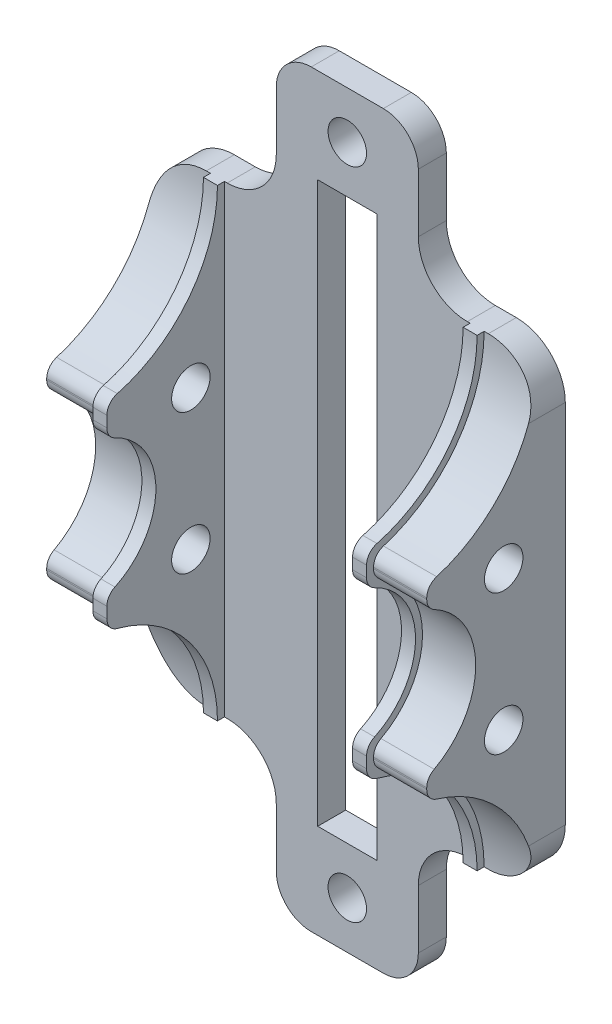
from build123d import *

# Parameters (mm, degrees)
SKETCH1_R               = 2.75
BOSS_EXTRUDE1_DEPTH     = 4
FILLET1_R               = 5
BOSS_EXTRUDE3_DEPTH     = 9.6
BOSS_EXTRUDE4_DEPTH     = 10
BOSS_EXTRUDE5_DEPTH     = 4
BOSS_EXTRUDE6_START     = -12
BOSS_EXTRUDE6_DEPTH     = 12
CUT_EXTRUDE1_START      = -10
CUT_EXTRUDE1_DEPTH      = 10
BOSS_EXTRUDE7_DEPTH     = 4
BOSS_EXTRUDE8_START     = -7.6
BOSS_EXTRUDE8_DEPTH     = 7.6
BOSS_EXTRUDE9_START     = 2
BOSS_EXTRUDE9_DEPTH     = 2
FILLET2_R               = 7
SKETCH15_W              = 8.45
SKETCH15_H              = 80
CUT_EXTRUDE2_DEPTH      = 14
FILLET3_R               = 2
CUT_EXTRUDE4_DEPTH      = 132.997651535
CUT_EXTRUDE4_DEPTH_BACK = 132.997651535
SKETCH17_R              = 2.75


with BuildPart() as part:
    # Sketch1 → Boss-Extrude1 (new body)
    with BuildSketch(Plane.XY):
        Polygon((-62.15, 75), (-69.55, 75), (-69.55, 65.75), (-62.15, 65.75), (-62.15, 64.25), (-69.55, 64.25), (-69.55, 55), (-62.15, 55), (-62.15, 11.5), (-41.85, 11.5), (-41.85, 55), (-34.45, 55), (-34.45, 64.25), (-41.85, 64.25), (-41.85, 65.75), (-34.45, 65.75), (-34.45, 75), (-41.85, 75), (-41.85, 118.5), (-62.15, 118.5), align=None)
        with Locations((-52, 111.75)):
            Circle(SKETCH1_R, mode=Mode.SUBTRACT)
        with Locations((-52, 18.25)):
            Circle(SKETCH1_R, mode=Mode.SUBTRACT)
    extrude(amount=BOSS_EXTRUDE1_DEPTH)

    # Fillet1
    fillet1_edges = [part.edges().sort_by_distance(p)[0] for p in [
        (-62.15, 118.5, 2),
        (-41.85, 118.5, 2),
        (-41.85, 11.5, 2),
        (-62.15, 11.5, 2),
    ]]
    fillet(fillet1_edges, radius=FILLET1_R)



with BuildPart() as body_2:
    # Sketch3 → Boss-Extrude3 (new body)
    with BuildSketch(Plane(origin=(-34.45, 0, 0), x_dir=(0, 0, -1), z_dir=(1, 0, 0))):
        with BuildLine():
            Line((-12.8, 65), (-4, 65))
            Line((-4, 65), (-4, 65.75))
            Line((-4, 65.75), (-4, 75))
            Line((-4, 75), (-4, 98.135455405))
            ThreePointArc((-4, 98.135455405), (-8.435930345, 85.488200598), (-19.8, 78.382677882))
            Line((-19.8, 78.382677882), (-19.8, 75.382677882))
            ThreePointArc((-19.8, 75.382677882), (-14.713450587, 71.260990337), (-12.8, 65))
        make_face()
        with BuildLine():
            Line((-4, 31.864544449), (-4, 65))
            Line((-4, 65), (-12.8, 65))
            ThreePointArc((-12.8, 65), (-14.713450587, 58.739009663), (-19.8, 54.617322118))
            Line((-19.8, 54.617322118), (-19.8, 51.617322118))
            ThreePointArc((-19.8, 51.617322118), (-8.435930299, 44.511799345), (-4, 31.864544449))
        make_face()
    extrude(amount=BOSS_EXTRUDE3_DEPTH)


with BuildPart() as part_1:
    add(part.part)

    add(body_2.part)  # Boss-Extrude4 merges body 2
    # Sketch5 → Boss-Extrude4 (add)
    with BuildSketch(Plane.ZY.offset(34.45)):
        with BuildLine():
            Line((4, 98.135455551), (4, 31.864544449))
            ThreePointArc((4, 31.864544449), (8.435930299, 44.511799345), (19.8, 51.617322118))
            Line((19.8, 51.617322118), (19.8, 54.617322118))
            ThreePointArc((19.8, 54.617322118), (12.8, 65), (19.8, 75.382677882))
            Line((19.8, 75.382677882), (19.8, 78.382677882))
            ThreePointArc((19.8, 78.382677882), (8.435930299, 85.488200655), (4, 98.135455551))
        make_face()
    extrude(amount=BOSS_EXTRUDE4_DEPTH)

    # Sketch6 → Boss-Extrude5 (add)
    with BuildSketch(Plane(origin=(0, 0, 4), x_dir=(-1, 0, 0), z_dir=(0, 0, -1))):
        Polygon((24.85, 31.864544449), (41.85, 31.864544449), (41.85, 55), (34.45, 55), (34.45, 64.25), (41.85, 64.25), (41.85, 65.75), (34.45, 65.75), (34.45, 75), (41.85, 75), (41.85, 98.135455551), (24.85, 98.135455551), align=None)
    extrude(amount=BOSS_EXTRUDE5_DEPTH)

    # Sketch9 → Boss-Extrude6 (add)
    with BuildSketch(Plane.ZY.offset(44.45).offset(BOSS_EXTRUDE6_START)):
        with BuildLine():
            Line((4, 31.864544449), (5, 31.864544449))
            ThreePointArc((5, 31.864544449), (9.468774813, 44.195523989), (20.8, 50.800547872))
            Line((20.8, 50.800547872), (20.8, 55.31495999))
            ThreePointArc((20.8, 55.31495999), (20.485627959, 55.424552796), (20.175, 55.544346929))
            ThreePointArc((20.175, 55.544346929), (13.8, 65), (20.175, 74.455653071))
            ThreePointArc((20.175, 74.455653071), (20.485627959, 74.575447204), (20.8, 74.68504001))
            Line((20.8, 74.68504001), (20.8, 79.199452128))
            ThreePointArc((20.8, 79.199452128), (9.468774813, 85.804476011), (5, 98.135455551))
            Line((5, 98.135455551), (4, 98.135455551))
            ThreePointArc((4, 98.135455551), (8.435930299, 85.488200655), (19.8, 78.382677882))
            Line((19.8, 78.382677882), (19.8, 75.382677882))
            ThreePointArc((19.8, 75.382677882), (12.8, 65), (19.8, 54.617322118))
            Line((19.8, 54.617322118), (19.8, 51.617322118))
            ThreePointArc((19.8, 51.617322118), (8.435930299, 44.511799345), (4, 31.864544449))
        make_face()
    extrude(amount=BOSS_EXTRUDE6_DEPTH)

    # Sketch10 → Cut-Extrude1 (cut)
    with BuildSketch(Plane.ZY.offset(44.45).offset(CUT_EXTRUDE1_START)):
        with BuildLine():
            Line((4, 98.135455551), (4, 31.864544449))
            Line((4, 31.864544449), (5, 31.864544449))
            ThreePointArc((5, 31.864544449), (9.468774813, 44.195523989), (20.8, 50.800547872))
            Line((20.8, 50.800547872), (20.8, 55.31495999))
            ThreePointArc((20.8, 55.31495999), (13.8, 65), (20.8, 74.68504001))
            Line((20.8, 74.68504001), (20.8, 79.199452128))
            ThreePointArc((20.8, 79.199452128), (9.468774813, 85.804476011), (5, 98.135455551))
            Line((5, 98.135455551), (4, 98.135455551))
        make_face()
    extrude(amount=CUT_EXTRUDE1_DEPTH, mode=Mode.SUBTRACT)

    # Sketch12 → Boss-Extrude7 (add)
    with BuildSketch(Plane.XY.offset(4)):
        Polygon((-79.15, 31.864544449), (-62.15, 31.864544449), (-62.15, 55), (-69.55, 55), (-69.55, 64.25), (-62.15, 64.25), (-62.15, 65.75), (-69.55, 65.75), (-69.55, 75), (-62.15, 75), (-62.15, 98.135455551), (-79.15, 98.135455551), align=None)
    extrude(amount=-BOSS_EXTRUDE7_DEPTH)

    # Sketch13 → Boss-Extrude8 (add)
    with BuildSketch(Plane.ZY.offset(79.15).offset(BOSS_EXTRUDE8_START)):
        with BuildLine():
            Line((19.8, 75.382677882), (19.8, 78.382677882))
            ThreePointArc((19.8, 78.382677882), (8.435930299, 85.488200655), (4, 98.135455551))
            Line((4, 98.135455551), (0, 98.135455551))
            Line((0, 98.135455551), (0, 31.864544449))
            Line((0, 31.864544449), (4, 31.864544449))
            ThreePointArc((4, 31.864544449), (8.435930299, 44.511799345), (19.8, 51.617322118))
            Line((19.8, 51.617322118), (19.8, 54.617322118))
            ThreePointArc((19.8, 54.617322118), (12.8, 65), (19.8, 75.382677882))
        make_face()
    extrude(amount=BOSS_EXTRUDE8_DEPTH)

    # Sketch14 → Boss-Extrude9 (add)
    with BuildSketch(Plane(origin=(-71.55, 0, 0), x_dir=(0, 0, -1), z_dir=(1, 0, 0)).offset(BOSS_EXTRUDE9_START)):
        with BuildLine():
            Line((-4, 98.135455551), (-5, 98.135455551))
            ThreePointArc((-5, 98.135455551), (-9.468774813, 85.804476011), (-20.8, 79.199452128))
            Line((-20.8, 79.199452128), (-20.8, 74.68504001))
            ThreePointArc((-20.8, 74.68504001), (-13.8, 65), (-20.8, 55.31495999))
            Line((-20.8, 55.31495999), (-20.8, 50.800547872))
            ThreePointArc((-20.8, 50.800547872), (-9.468774813, 44.195523989), (-5, 31.864544449))
            Line((-5, 31.864544449), (-4, 31.864544449))
            Line((-4, 31.864544449), (-4, 98.135455551))
        make_face()
    extrude(amount=-BOSS_EXTRUDE9_DEPTH)

    # Fillet2
    fillet2_edges = [part_1.edges().sort_by_distance(p)[0] for p in [
        (-24.85, 98.135455551, 2),
        (-24.85, 31.864544449, 2),
        (-41.85, 31.864544449, 2),
        (-41.85, 98.135455551, 2),
        (-79.15, 31.864544449, 2),
        (-79.15, 98.135455551, 2),
        (-62.15, 98.135455551, 2),
        (-62.15, 31.864544449, 2),
    ]]
    fillet(fillet2_edges, radius=FILLET2_R)

    # Sketch15 → Cut-Extrude2 (cut)
    with BuildSketch(Plane(origin=(0, 0, 0), x_dir=(-1, 0, 0), z_dir=(0, 0, -1))):
        with Locations((52, 65)):
            Rectangle(SKETCH15_W, SKETCH15_H)
    extrude(amount=-CUT_EXTRUDE2_DEPTH, mode=Mode.SUBTRACT)

    # Fillet3
    fillet3_edges = [part_1.edges().sort_by_distance(p)[0] for p in [
        (-28.65, 75.382677882, 19.8),
        (-28.65, 78.382677882, 19.8),
        (-28.65, 54.617322118, 19.8),
        (-28.65, 51.617322118, 19.8),
        (-33.45, 50.800547872, 20.8),
        (-33.45, 79.199452128, 20.8),
        (-33.45, 74.68504001, 20.8),
        (-33.45, 55.31495999, 20.8),
        (-75.35, 78.382677882, 19.8),
        (-75.35, 75.382677882, 19.8),
        (-75.35, 54.617322118, 19.8),
        (-75.35, 51.617322118, 19.8),
        (-70.55, 79.199452128, 20.8),
        (-70.55, 74.68504001, 20.8),
        (-70.55, 55.31495999, 20.8),
        (-70.55, 50.800547872, 20.8),
    ]]
    fillet(fillet3_edges, radius=FILLET3_R)

    # Sketch17 → Cut-Extrude4 (cut, two sides: drawn at the far end of the back side and taken through both)
    with BuildSketch(Plane(origin=(-24.85, 0, 0), x_dir=(0, 0, -1), z_dir=(1, 0, 0)).offset(-CUT_EXTRUDE4_DEPTH_BACK)):
        with Locations((-8.8, 75)):
            Circle(SKETCH17_R)
        with Locations((-8.8, 55)):
            Circle(SKETCH17_R)
    extrude(amount=CUT_EXTRUDE4_DEPTH + CUT_EXTRUDE4_DEPTH_BACK, mode=Mode.SUBTRACT)


solid = part_1.part
